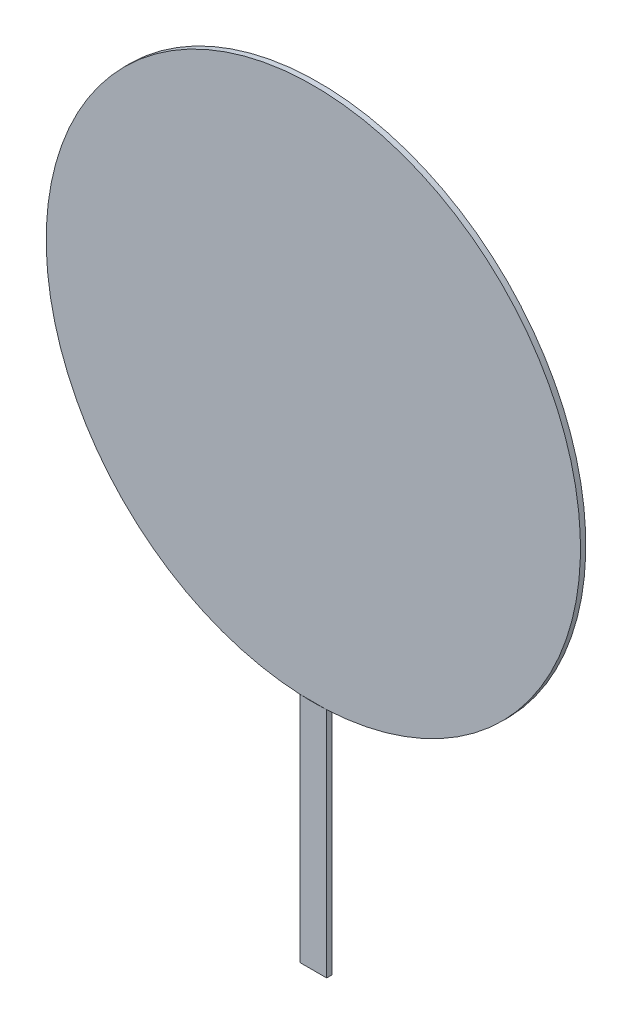
from build123d import *

# Parameters (mm, degrees)
EXTRUDE_2_DEPTH   = 2
EXTRUDE_2_2_DEPTH = 2


with BuildPart() as part:
    # 草图1 → 凸台-拉伸2 (new body)
    with BuildSketch(Plane.XY):
        with BuildLine():
            ThreePointArc((4.999120694, -99.874965794), (-0.000880407, -99.999999996), (-5.000879306, -99.874877753))
            Line((-5.000879306, -99.874877753), (-5.000879306, -186.847638142))
            Line((-5.000879306, -186.847638142), (4.999120694, -186.847638142))
            Line((4.999120694, -186.847638142), (4.999120694, -99.874965794))
        make_face()
    extrude(amount=EXTRUDE_2_DEPTH)


with BuildPart() as body_2:
    # 草图1 → Extrude 2 2 (new body)
    with BuildSketch(Plane.XY):
        with BuildLine():
            Line((-5.000879306, -99.874877753), (-5.000879306, -99.872723805))
            Line((-5.000879306, -99.872723805), (4.999120694, -99.872723805))
            Line((4.999120694, -99.872723805), (4.999120694, -99.874965794))
            ThreePointArc((4.999120694, -99.874965794), (72.456580341, -68.920562718), (100, 0))
            ThreePointArc((100, 0), (-68.919924802, 72.45718712), (-5.000879306, -99.874877753))
        make_face()
    extrude(amount=EXTRUDE_2_2_DEPTH)


solid = Compound([part.part, body_2.part])
